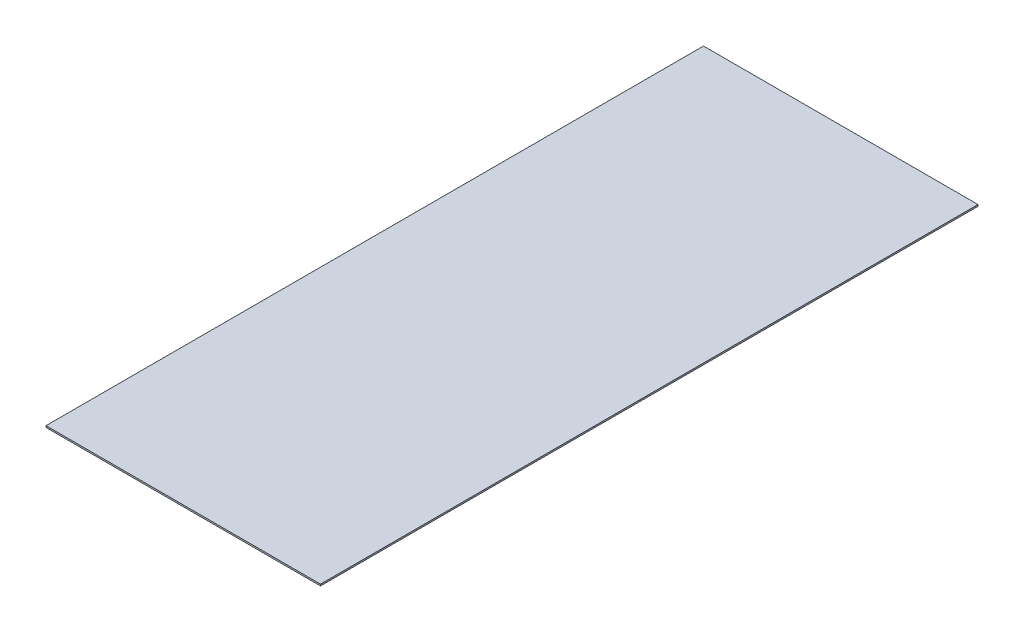
from build123d import *

# Parameters (mm, degrees)
SKETCH1_W           = 1092.2
SKETCH1_H           = 2616.2
BOSS_EXTRUDE1_DEPTH = 6.35


with BuildPart() as part:
    # Sketch1 → Boss-Extrude1 (new body)
    with BuildSketch(Plane(origin=(0, 0, 0), x_dir=(1, 0, 0), z_dir=(0, 1, 0))):
        Rectangle(SKETCH1_W, SKETCH1_H)
    extrude(amount=BOSS_EXTRUDE1_DEPTH)


solid = part.part
